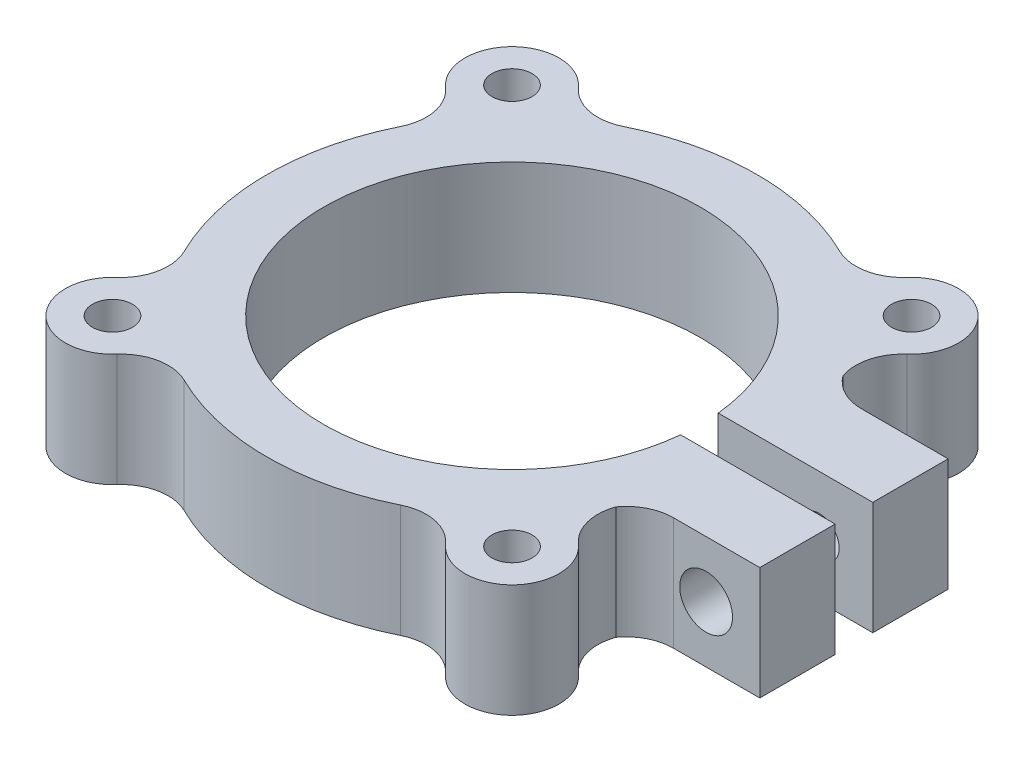
from build123d import *

# Parameters (mm, degrees)
BOSS_EXTRUDE1_DEPTH        = 7.62
CUT_EXTRUDE1_DEPTH         = 30.441514138
SKETCH3_W                  = 12.7
SKETCH3_H                  = 7.62
M2_5_CLEARANCE_HOLE1_D     = 2.7051
M3_CLEARANCE_HOLE1_D       = 3.556
M3_CLEARANCE_HOLE1_DEPTH   = 5.08
M2_5_CLEARANCE_HOLE2_D     = 2.7051
M2_5_CLEARANCE_HOLE2_DEPTH = 15.375384182


with BuildPart() as part:
    # Sketch1 → Boss-Extrude1 (new body)
    with BuildSketch(Plane.XZ):
        with BuildLine():
            Line((17.227118157, -6.35), (23.057960451, -6.35))
            Line((23.057960451, -6.35), (23.057960451, 6.35))
            Line((23.057960451, 6.35), (17.227118157, 6.35))
            ThreePointArc((17.227118157, 6.35), (15.786457002, 6.695667846), (14.659490486, 7.657404449))
            ThreePointArc((14.659490486, 7.657404449), (14.589471792, 9.508848608), (15.564771332, 11.084138707))
            ThreePointArc((15.564771332, 11.084138707), (15.715448212, 15.715448212), (11.084138707, 15.564771332))
            ThreePointArc((11.084138707, 15.564771332), (9.317430783, 14.545190239), (7.295007228, 14.810907114))
            ThreePointArc((7.295007228, 14.810907114), (0, 16.51), (-7.295007228, 14.810907114))
            ThreePointArc((-7.295007228, 14.810907114), (-9.317430783, 14.545190239), (-11.084138707, 15.564771332))
            ThreePointArc((-11.084138707, 15.564771332), (-15.715448212, 15.715448212), (-15.564771332, 11.084138707))
            ThreePointArc((-15.564771332, 11.084138707), (-14.545190239, 9.317430783), (-14.810907114, 7.295007228))
            ThreePointArc((-14.810907114, 7.295007228), (-16.51, 0), (-14.810907114, -7.295007228))
            ThreePointArc((-14.810907114, -7.295007228), (-14.545190239, -9.317430783), (-15.564771332, -11.084138707))
            ThreePointArc((-15.564771332, -11.084138707), (-15.715448212, -15.715448212), (-11.084138707, -15.564771332))
            ThreePointArc((-11.084138707, -15.564771332), (-9.317430783, -14.545190239), (-7.295007228, -14.810907114))
            ThreePointArc((-7.295007228, -14.810907114), (0, -16.51), (7.295007228, -14.810907114))
            ThreePointArc((7.295007228, -14.810907114), (9.317430783, -14.545190239), (11.084138707, -15.564771332))
            ThreePointArc((11.084138707, -15.564771332), (15.715448212, -15.715448212), (15.564771332, -11.084138707))
            ThreePointArc((15.564771332, -11.084138707), (14.589471792, -9.508848608), (14.659490486, -7.657404449))
            ThreePointArc((14.659490486, -7.657404449), (15.786457002, -6.695667846), (17.227118157, -6.35))
        make_face()
    extrude(amount=-BOSS_EXTRUDE1_DEPTH)

    # Sketch2 → Cut-Extrude1 (cut, through all)
    with BuildSketch(Plane(origin=(0, 7.62, 0), x_dir=(-1, 0, 0), z_dir=(0, 1, 0))):
        with BuildLine():
            Line((-23.057960451, 1.27), (-23.057960451, -1.27))
            Line((-23.057960451, -1.27), (-12.636340451, -1.27))
            ThreePointArc((-12.636340451, -1.27), (-12.7, 0), (-12.636340451, 1.27))
            Line((-12.636340451, 1.27), (-23.057960451, 1.27))
        make_face()
    extrude(amount=-CUT_EXTRUDE1_DEPTH, mode=Mode.SUBTRACT)

    # Sketch3 → Cut-Revolve1 (revolve, cut)
    with BuildSketch(Plane.XY):
        with Locations((6.35, 3.81)):
            Rectangle(SKETCH3_W, SKETCH3_H)
    revolve(axis=Axis((0, 7.62, 0), (0, -1, 0)), mode=Mode.SUBTRACT)

    # M2.5 Clearance Hole1 (through all)
    with Locations(Plane(origin=(0, 0, 0), x_dir=(-1, 0, 0), z_dir=(0, -1, 0))):
        with Locations((-13.470384182, -13.470384182), (13.470384182, -13.470384182), (13.470384182, 13.470384182), (-13.470384182, 13.470384182)):
            Hole(M2_5_CLEARANCE_HOLE1_D / 2)

    # M3 Clearance Hole1
    with Locations(Plane.XY.offset(6.35)):
        with Locations((19.438793191, 3.81)):
            Hole(M3_CLEARANCE_HOLE1_D / 2, depth=M3_CLEARANCE_HOLE1_DEPTH)

    # M2.5 Clearance Hole2
    with Locations(Plane.XY.offset(-1.27)):
        with Locations((19.438793191, 3.81)):
            Hole(M2_5_CLEARANCE_HOLE2_D / 2, depth=M2_5_CLEARANCE_HOLE2_DEPTH)


solid = part.part
